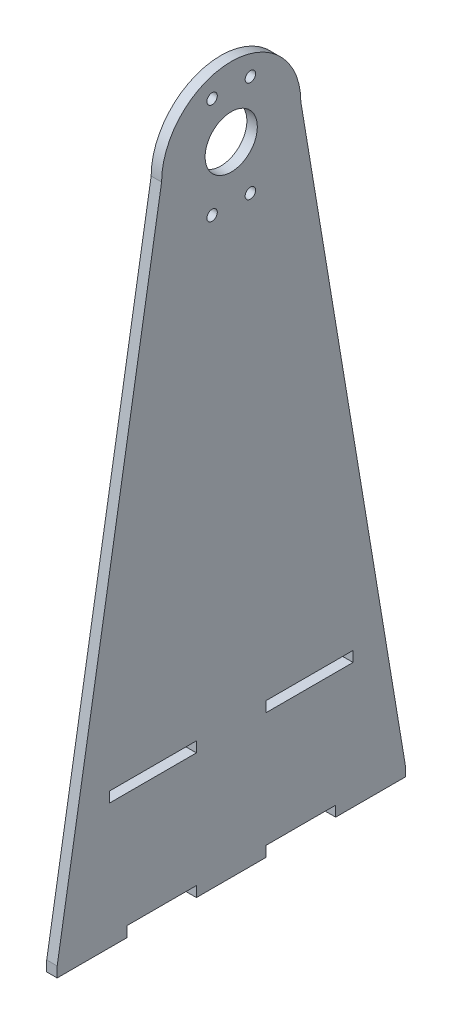
from build123d import *

# Parameters (mm, degrees)
SKETCH2_R           = 7.5
BOSS_EXTRUDE1_DEPTH = 1.5
SKETCH3_W           = 25
SKETCH3_H           = 3
CUT_EXTRUDE1_DEPTH  = 4
SKETCH4_W           = 3
SKETCH4_H           = 20
BOSS_EXTRUDE2_DEPTH = 3
SKETCH5_R           = 1.5
CUT_EXTRUDE2_DEPTH  = 10


with BuildPart() as part:
    # Sketch2 → Boss-Extrude1 (new, symmetric)
    with BuildSketch(Plane(origin=(0, 0, 0), x_dir=(0, 0, -1), z_dir=(1, 0, 0))):
        with BuildLine():
            Line((50, 0), (-50, 0))
            Line((-50, 0), (-20, 180))
            ThreePointArc((-20, 180), (0, 200), (20, 180))
            Line((20, 180), (50, 0))
        make_face()
        with Locations((0, 180)):
            Circle(SKETCH2_R, mode=Mode.SUBTRACT)
    extrude(amount=BOSS_EXTRUDE1_DEPTH, both=True)

    # Sketch3 → Cut-Extrude1 (cut)
    with BuildSketch(Plane.ZY.offset(1.5)):
        with Locations((22.5, 34.5)):
            Rectangle(SKETCH3_W, SKETCH3_H)
        with Locations((-22.5, 34.5)):
            Rectangle(SKETCH3_W, SKETCH3_H)
    extrude(amount=-CUT_EXTRUDE1_DEPTH, mode=Mode.SUBTRACT)

    # Sketch4 → Boss-Extrude2 (add)
    with BuildSketch(Plane.XZ):
        Rectangle(SKETCH4_W, SKETCH4_H)
        with Locations((0, -40)):
            Rectangle(SKETCH4_W, SKETCH4_H)
        with Locations((0, 40)):
            Rectangle(SKETCH4_W, SKETCH4_H)
    extrude(amount=BOSS_EXTRUDE2_DEPTH)

    # Sketch5 → Cut-Extrude2 (cut)
    with BuildSketch(Plane(origin=(1.5, 0, 0), x_dir=(0, 0, -1), z_dir=(1, 0, 0))):
        with Locations((-5.5, 193.5)):
            Circle(SKETCH5_R)
        with Locations((-5.5, 164.5)):
            Circle(SKETCH5_R)
        with Locations((5.5, 164.5)):
            Circle(SKETCH5_R)
        with Locations((5.5, 193.5)):
            Circle(SKETCH5_R)
    extrude(amount=-CUT_EXTRUDE2_DEPTH, mode=Mode.SUBTRACT)


solid = part.part
